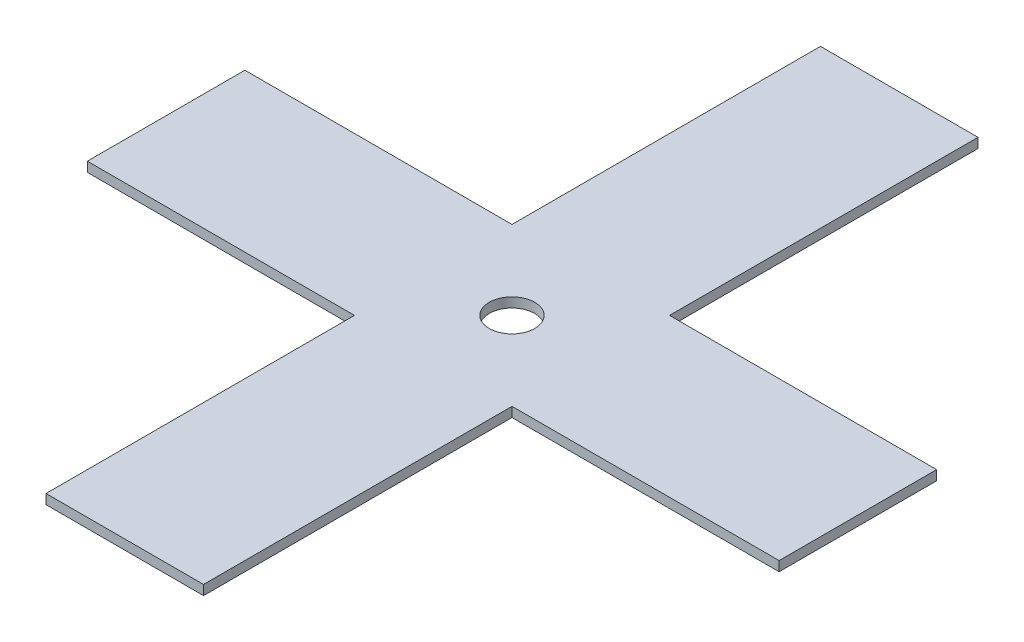
from build123d import *

# Parameters (mm, degrees)
SKETCH1_R           = 2.75
BOSS_EXTRUDE1_DEPTH = 1.175


with BuildPart() as part:
    # Sketch1 → Boss-Extrude1 (new body)
    with BuildSketch(Plane(origin=(0, 0, 0), x_dir=(1, 0, 0), z_dir=(0, 1, 0))):
        Polygon((0, 0), (0, 37.3), (-32.3, 37.3), (-32.3, 56.35), (0, 56.35), (0, 93.65), (19.05, 93.65), (19.05, 56.35), (51.35, 56.35), (51.35, 37.3), (19.05, 37.3), (19.05, 0), align=None)
        with Locations(Location((9.525, 46.825, 0), (0, 0, 270))):
            Circle(SKETCH1_R, mode=Mode.SUBTRACT)
    extrude(amount=BOSS_EXTRUDE1_DEPTH)


solid = part.part
